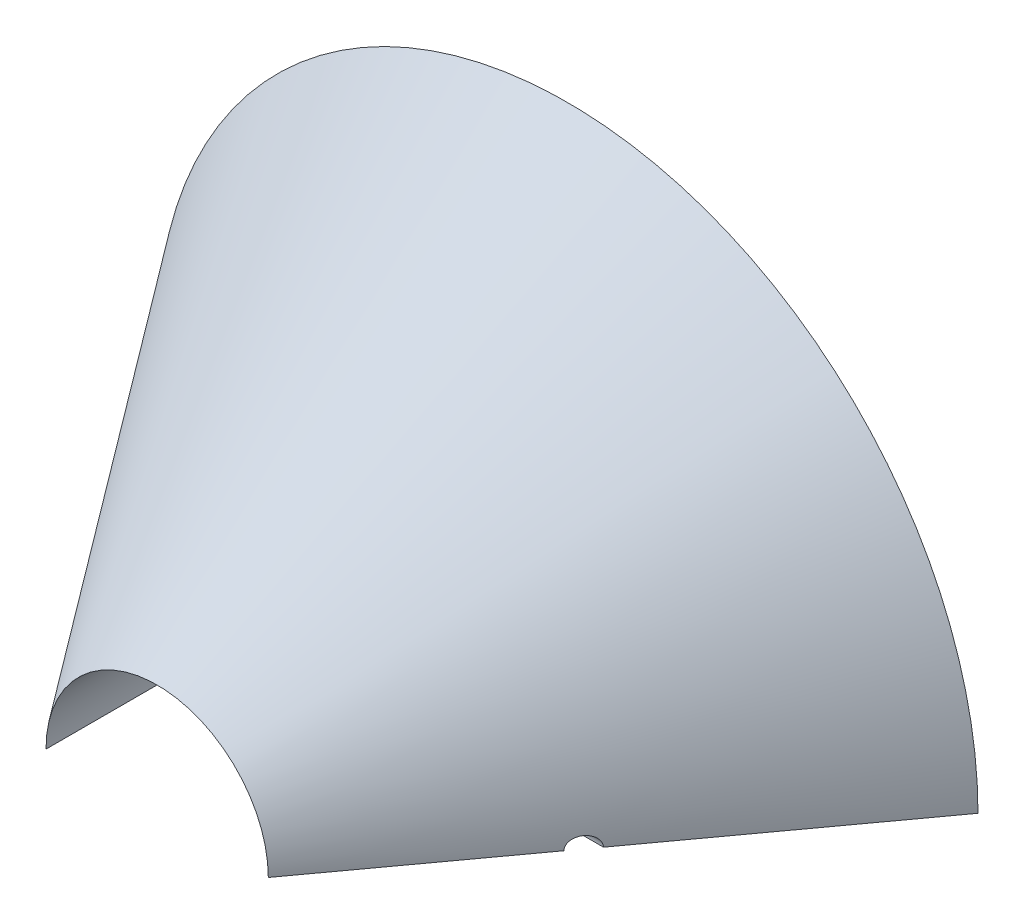
from build123d import *

# Parameters (mm, degrees)
ENL_V_MAT_EXTRU_1_REACH = 313.769
ESQUISSE7_R             = 5


with BuildPart() as part:
    # Esquisse4 → Révolution1 (revolve)
    with BuildSketch(Plane(origin=(0, 0, 0), x_dir=(0, 0, -1), z_dir=(1, 0, 0)), mode=Mode.PRIVATE) as r_volution1_sk:
        Polygon((-180, 48.75), (0, 180), (0, 48.75), align=None)
    revolve(r_volution1_sk.sketch.rotate(Axis((0, 0, 180), (0, 0, -1)), 90), axis=Axis((0, 0, 180), (0, 0, -1)))

    # Enlèv. mat.-Extru.1: up to this cone (the profile starts inside it)
    enl_v_mat_extru_1_end = Plane(origin=(0, 0, 100), z_dir=(0, 0, -1)).offset(-146.857141857) * Cone(1e-06, 414.319409722, 568.20947519, align=(Align.CENTER, Align.CENTER, Align.MIN), mode=Mode.PRIVATE)
    # Esquisse7 → Enlèv. mat.-Extru.1 (cut, up to the surface)
    with BuildSketch(Plane(origin=(0, 0, 0), x_dir=(0, 0, -1), z_dir=(1, 0, 0)), mode=Mode.PRIVATE) as enl_v_mat_extru_1_sk1:
        with Locations(Location((-100, 0, 0), (0, 0, 180))):
            Circle(ESQUISSE7_R)
    enl_v_mat_extru_1_tool1 = extrude(enl_v_mat_extru_1_sk1.sketch, amount=ENL_V_MAT_EXTRU_1_REACH, mode=Mode.PRIVATE) & enl_v_mat_extru_1_end
    add(enl_v_mat_extru_1_tool1.solids().sort_by_distance((0, 0, 100))[0], mode=Mode.SUBTRACT)

    # Enlèv. mat.-Surface1
    split(bisect_by=Plane(origin=(0, 0, 0), x_dir=(1, 0, 0), z_dir=(0, 1, 0)), keep=Keep.TOP)


solid = part.part
